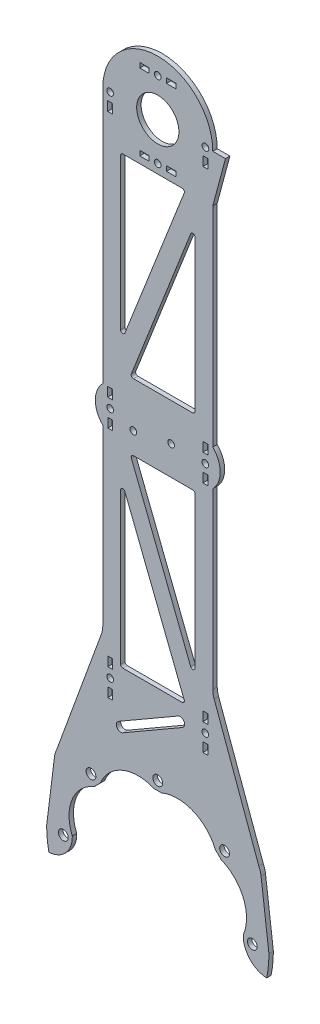
from build123d import *

# Parameters (mm, degrees)
SKETCH_1_R      = 2.2
SKETCH_1_R_2    = 9.5
SKETCH_1_R_3    = 1.5
SKETCH_1_W      = 4.2
SKETCH_1_H      = 2.2
SKETCH_1_W_2    = 2.2
SKETCH_1_H_2    = 4.2
EXTRUDE_1_DEPTH = 2


with BuildPart() as part:
    # 草图1 → 凸台-拉伸1 (new body)
    with BuildSketch(Plane.XY):
        with BuildLine():
            Line((46.461426923, -96.447469622), (50, -125))
            ThreePointArc((50, -125), (49.748623245, -130.007441937), (48.997020592, -134.964533673))
            ThreePointArc((48.997020592, -134.964533673), (41.359915291, -131.321748354), (38.465512908, -123.370792619))
            ThreePointArc((38.465512908, -123.370792619), (38.545793672, -109.14087841), (28.474561687, -99.087660532))
            ThreePointArc((28.474561687, -99.087660532), (27.223611076, -97.776388924), (25.912339468, -96.525438313))
            ThreePointArc((25.912339468, -96.525438313), (15.85912159, -86.454206328), (1.629207381, -86.534487092))
            ThreePointArc((1.629207381, -86.534487092), (0, -86.5), (-1.629207381, -86.534487092))
            ThreePointArc((-1.629207381, -86.534487092), (-15.85912159, -86.454206328), (-25.912339468, -96.525438313))
            ThreePointArc((-25.912339468, -96.525438313), (-27.223611076, -97.776388924), (-28.474561687, -99.087660532))
            ThreePointArc((-28.474561687, -99.087660532), (-38.545793672, -109.14087841), (-38.465512908, -123.370792619))
            ThreePointArc((-38.465512908, -123.370792619), (-41.359915692, -131.321748192), (-48.997021107, -134.964533236))
            ThreePointArc((-48.997021107, -134.964533236), (-49.748623375, -130.007441694), (-50, -125))
            Line((-50, -125), (-46.461426923, -96.447469622))
            ThreePointArc((-46.461426923, -96.447469622), (-46.109594707, -94.783919835), (-45.481011279, -93.204025321))
            Line((-45.481011279, -93.204025321), (-25.348989293, -38.09742115))
            ThreePointArc((-25.348989293, -38.09742115), (-24.894773191, -36.408340658), (-24.741807932, -34.665955281))
            Line((-24.741807932, -34.665955281), (-24.741807932, -20.235407124))
            Line((-24.741807932, -20.235407124), (-24.741807932, 0))
            Line((-24.741807932, 0), (-24.741807932, 43.564592876))
            ThreePointArc((-24.741807932, 43.564592876), (-28.096937788, 51.664592876), (-24.741807932, 59.764592876))
            Line((-24.741807932, 59.764592876), (-24.741807932, 174.996783477))
            ThreePointArc((-24.741807932, 174.996783477), (0, 199.73859141), (24.741807932, 174.996783477))
            Line((24.741807932, 174.996783477), (30.452369558, 174.996783477))
            Line((30.452369558, 174.996783477), (24.741807932, 153.730120274))
            Line((24.741807932, 153.730120274), (24.741807932, 66.020820772))
            Line((24.741807932, 66.020820772), (24.741807932, 59.764592876))
            ThreePointArc((24.741807932, 59.764592876), (28.096937788, 51.664592876), (24.741807932, 43.564592876))
            Line((24.741807932, 43.564592876), (24.741807932, 37.305457961))
            Line((24.741807932, 37.305457961), (24.741807932, 0))
            Line((24.741807932, 0), (24.741807932, -20.235407124))
            Line((24.741807932, -20.235407124), (24.741807932, -34.665955281))
            ThreePointArc((24.741807932, -34.665955281), (24.894773191, -36.408340658), (25.348989293, -38.09742115))
            Line((25.348989293, -38.09742115), (45.481011279, -93.204025321))
            ThreePointArc((45.481011279, -93.204025321), (46.109594707, -94.783919835), (46.461426923, -96.447469622))
        make_face()
        with Locations((-42.5, -125)):
            Circle(SKETCH_1_R, mode=Mode.SUBTRACT)
        with Locations((-30.0520382, -94.9479618)):
            Circle(SKETCH_1_R, mode=Mode.SUBTRACT)
        with Locations((0, -82.5)):
            Circle(SKETCH_1_R, mode=Mode.SUBTRACT)
        with Locations((30.0520382, -94.9479618)):
            Circle(SKETCH_1_R, mode=Mode.SUBTRACT)
        with Locations((42.5, -125)):
            Circle(SKETCH_1_R, mode=Mode.SUBTRACT)
        with Locations((2.09e-07, 174.996783477)):
            Circle(SKETCH_1_R_2, mode=Mode.SUBTRACT)
        with Locations((0, 192.120903966)):
            Circle(SKETCH_1_R_3, mode=Mode.SUBTRACT)
        with Locations(Location((0, 157.879096034, 0), (0, 0, 180))):
            Circle(SKETCH_1_R_3, mode=Mode.SUBTRACT)
        with Locations((-21.392054648, -53.335407124)):
            Circle(SKETCH_1_R_3, mode=Mode.SUBTRACT)
        with Locations((-21.392054648, 51.664592876)):
            Circle(SKETCH_1_R_3, mode=Mode.SUBTRACT)
        with Locations(Location((21.392054648, -53.335407124, 0), (0, 0, 180))):
            Circle(SKETCH_1_R_3, mode=Mode.SUBTRACT)
        with Locations(Location((21.392054648, 51.664592876, 0), (0, 0, 180))):
            Circle(SKETCH_1_R_3, mode=Mode.SUBTRACT)
        with Locations(Location((21.447993697, 175, 0), (0, 0, 180))):
            Circle(SKETCH_1_R_3, mode=Mode.SUBTRACT)
        with Locations((-21.447993697, 175)):
            Circle(SKETCH_1_R_3, mode=Mode.SUBTRACT)
        with Locations((-10.976092936, 48.238908927)):
            Circle(SKETCH_1_R_3, mode=Mode.SUBTRACT)
        with Locations((6, 51.664592876)):
            Circle(SKETCH_1_R_3, mode=Mode.SUBTRACT)
        with Locations((6, 192.120903966)):
            Rectangle(SKETCH_1_W, SKETCH_1_H, mode=Mode.SUBTRACT)
        with Locations((-6, 192.120903966)):
            Rectangle(SKETCH_1_W, SKETCH_1_H, mode=Mode.SUBTRACT)
        with Locations((21.392054648, -47.335407124)):
            Rectangle(SKETCH_1_W_2, SKETCH_1_H_2, mode=Mode.SUBTRACT)
        with Locations((21.392054648, 45.664592876)):
            Rectangle(SKETCH_1_W_2, SKETCH_1_H_2, mode=Mode.SUBTRACT)
        with Locations((-21.447993697, 57.664592876)):
            Rectangle(SKETCH_1_W_2, SKETCH_1_H_2, mode=Mode.SUBTRACT)
        with Locations((-6, 157.879096034)):
            Rectangle(SKETCH_1_W, SKETCH_1_H, mode=Mode.SUBTRACT)
        with Locations((6, 157.879096034)):
            Rectangle(SKETCH_1_W, SKETCH_1_H, mode=Mode.SUBTRACT)
        with Locations((-21.392054648, -47.335407124)):
            Rectangle(SKETCH_1_W_2, SKETCH_1_H_2, mode=Mode.SUBTRACT)
        with Locations((-21.392054648, -59.335407124)):
            Rectangle(SKETCH_1_W_2, SKETCH_1_H_2, mode=Mode.SUBTRACT)
        with Locations((-21.392054648, 45.664592876)):
            Rectangle(SKETCH_1_W_2, SKETCH_1_H_2, mode=Mode.SUBTRACT)
        with BuildLine():
            Line((11.056492434, -56.33298533), (-15.666877498, -71.761730154))
            ThreePointArc((-15.666877498, -71.761730154), (-18.398928306, -71.029679346), (-17.666877498, -68.297628539))
            Line((-17.666877498, -68.297628539), (9.056492434, -52.868883715))
            ThreePointArc((9.056492434, -52.868883715), (11.788543242, -53.600934522), (11.056492434, -56.33298533))
        make_face(mode=Mode.SUBTRACT)
        with Locations((21.392054648, -59.335407124)):
            Rectangle(SKETCH_1_W_2, SKETCH_1_H_2, mode=Mode.SUBTRACT)
        with Locations((21.447993697, 57.664592876)):
            Rectangle(SKETCH_1_W_2, SKETCH_1_H_2, mode=Mode.SUBTRACT)
        with Locations((21.447993697, 169)):
            Rectangle(SKETCH_1_W_2, SKETCH_1_H_2, mode=Mode.SUBTRACT)
        with Locations((-21.447993697, 169)):
            Rectangle(SKETCH_1_W_2, SKETCH_1_H_2, mode=Mode.SUBTRACT)
        with BuildLine():
            Line((-16.741807932, 22.356006795), (-16.741807932, -45.600934522))
            ThreePointArc((-16.741807932, -45.600934522), (-16.448914714, -46.308041303), (-15.741807932, -46.600934522))
            Line((-15.741807932, -46.600934522), (10.976092936, -46.600934522))
            ThreePointArc((10.976092936, -46.600934522), (11.802499596, -46.164008258), (11.906748707, -45.235038586))
            Line((11.906748707, -45.235038586), (-14.811152161, 22.721902731))
            ThreePointArc((-14.811152161, 22.721902731), (-15.928012429, 23.338517806), (-16.741807932, 22.356006795))
        make_face(mode=Mode.SUBTRACT)
        with BuildLine():
            Line((-10.976092936, 38.564592876), (15.741807932, 38.564592876))
            ThreePointArc((15.741807932, 38.564592876), (16.448914714, 38.271699657), (16.741807932, 37.564592876))
            Line((16.741807932, 37.564592876), (16.741807932, -30.392348442))
            ThreePointArc((16.741807932, -30.392348442), (15.928012429, -31.374859452), (14.811152161, -30.758244377))
            Line((14.811152161, -30.758244377), (-11.906748707, 37.19869694))
            ThreePointArc((-11.906748707, 37.19869694), (-11.802499596, 38.127666612), (-10.976092936, 38.564592876))
        make_face(mode=Mode.SUBTRACT)
        with BuildLine():
            Line((14.811152161, 137.887430129), (-11.906748707, 69.930488812))
            ThreePointArc((-11.906748707, 69.930488812), (-11.802499596, 69.00151914), (-10.976092936, 68.564592876))
            Line((-10.976092936, 68.564592876), (15.741807932, 68.564592876))
            ThreePointArc((15.741807932, 68.564592876), (16.448914714, 68.857486095), (16.741807932, 69.564592876))
            Line((16.741807932, 69.564592876), (16.741807932, 137.521534193))
            ThreePointArc((16.741807932, 137.521534193), (15.928012429, 138.504045204), (14.811152161, 137.887430129))
        make_face(mode=Mode.SUBTRACT)
        with BuildLine():
            Line((11.906748707, 152.364224338), (-14.811152161, 84.407283021))
            ThreePointArc((-14.811152161, 84.407283021), (-15.928012429, 83.790667946), (-16.741807932, 84.773178956))
            Line((-16.741807932, 84.773178956), (-16.741807932, 152.730120274))
            ThreePointArc((-16.741807932, 152.730120274), (-16.448914714, 153.437227055), (-15.741807932, 153.730120274))
            Line((-15.741807932, 153.730120274), (10.976092936, 153.730120274))
            ThreePointArc((10.976092936, 153.730120274), (11.802499596, 153.29319401), (11.906748707, 152.364224338))
        make_face(mode=Mode.SUBTRACT)
    extrude(amount=EXTRUDE_1_DEPTH)


solid = part.part
